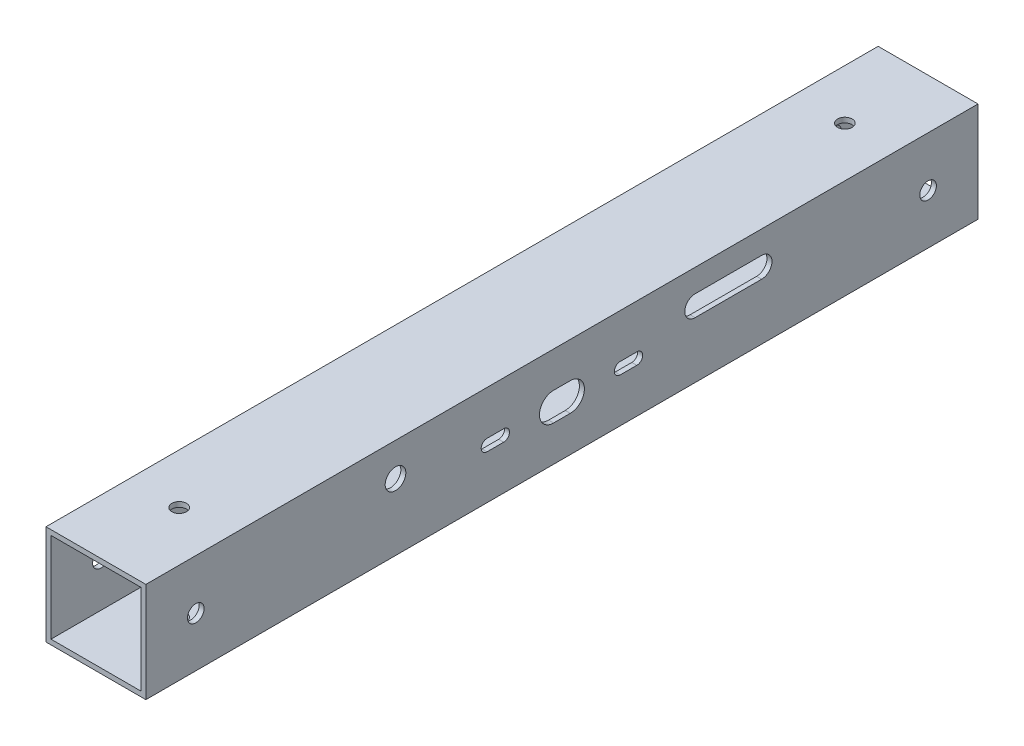
from build123d import *

# Parameters (mm, degrees)
SKETCH1_W           = 30
SKETCH1_H           = 30
SKETCH1_W_2         = 27
SKETCH1_H_2         = 27
BOSS_EXTRUDE1_DEPTH = 250
SKETCH2_R           = 2.5
SKETCH2_R_2         = 3.1
CUT_EXTRUDE1_DEPTH  = 254.574446662
SKETCH3_R           = 2.2
CUT_EXTRUDE2_DEPTH  = 254.574446662


with BuildPart() as part:
    # Sketch1 → Boss-Extrude1 (new body)
    with BuildSketch(Plane.XY):
        with Locations((15, 15)):
            Rectangle(SKETCH1_W, SKETCH1_H)
        with Locations((15, 15)):
            Rectangle(SKETCH1_W_2, SKETCH1_H_2, mode=Mode.SUBTRACT)
    extrude(amount=BOSS_EXTRUDE1_DEPTH)

    # Sketch2 → Cut-Extrude1 (cut, through all)
    with BuildSketch(Plane(origin=(30, 0, 0), x_dir=(0, 0, -1), z_dir=(1, 0, 0))):
        with Locations((-15, 15)):
            Circle(SKETCH2_R)
        with Locations((-235, 15)):
            Circle(SKETCH2_R)
        with Locations((-175, 20)):
            Circle(SKETCH2_R_2)
        with BuildLine():
            Line((-142.5, 16.75), (-147.5, 16.75))
            ThreePointArc((-147.5, 16.75), (-149.25, 15), (-147.5, 13.25))
            Line((-147.5, 13.25), (-142.5, 13.25))
            ThreePointArc((-142.5, 13.25), (-140.75, 15), (-142.5, 16.75))
        make_face()
        with BuildLine():
            Line((-107.5, 16.75), (-102.5, 16.75))
            ThreePointArc((-102.5, 16.75), (-100.75, 15), (-102.5, 13.25))
            Line((-102.5, 13.25), (-107.5, 13.25))
            ThreePointArc((-107.5, 13.25), (-109.25, 15), (-107.5, 16.75))
        make_face()
        with BuildLine():
            Line((-125, 19.25), (-127.5, 19.25))
            ThreePointArc((-127.5, 19.25), (-131.75, 15), (-127.5, 10.75))
            Line((-127.5, 10.75), (-125, 10.75))
            Line((-125, 10.75), (-122.5, 10.75))
            ThreePointArc((-122.5, 10.75), (-118.25, 15), (-122.5, 19.25))
            Line((-122.5, 19.25), (-125, 19.25))
        make_face()
        with BuildLine():
            Line((-75, 23.1), (-85, 23.1))
            ThreePointArc((-85, 23.1), (-88.1, 20), (-85, 16.9))
            Line((-85, 16.9), (-75, 16.9))
            Line((-75, 16.9), (-65, 16.9))
            ThreePointArc((-65, 16.9), (-61.9, 20), (-65, 23.1))
            Line((-65, 23.1), (-75, 23.1))
        make_face()
    extrude(amount=-CUT_EXTRUDE1_DEPTH, mode=Mode.SUBTRACT)

    # Sketch3 → Cut-Extrude2 (cut, through all)
    with BuildSketch(Plane(origin=(0, 30, 0), x_dir=(1, 0, 0), z_dir=(0, 1, 0))):
        with Locations(Location((15, -25, 0), (0, 0, 270))):
            Circle(SKETCH3_R)
        with Locations(Location((15, -225, 0), (0, 0, 270))):
            Circle(SKETCH3_R)
    extrude(amount=-CUT_EXTRUDE2_DEPTH, mode=Mode.SUBTRACT)


solid = part.part
